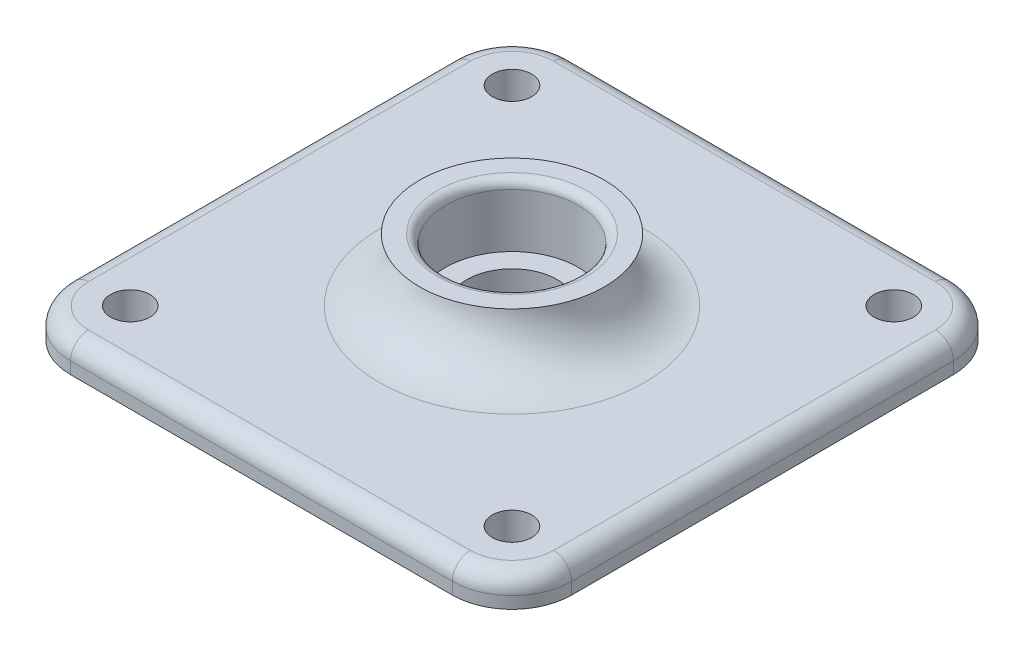
from build123d import *

# Parameters (mm, degrees)
BOSS_EXTRUDE1_DEPTH      = 5
FILLET1_R                = 3
M6_CLEARANCE_HOLE1_D     = 6.6
M6_CLEARANCE_HOLE1_DEPTH = 8
M6_CLEARANCE_HOLE1_TIP   = 1.982840043


with BuildPart() as part:
    # Sketch1 → Boss-Extrude1 (new body)
    with BuildSketch(Plane(origin=(0, 0, 0), x_dir=(1, 0, 0), z_dir=(0, 1, 0))):
        with BuildLine():
            Line((32, 42), (-32, 42))
            ThreePointArc((-32, 42), (-39.071067812, 39.071067812), (-42, 32))
            Line((-42, 32), (-42, -32))
            ThreePointArc((-42, -32), (-39.071067812, -39.071067812), (-32, -42))
            Line((-32, -42), (32, -42))
            ThreePointArc((32, -42), (39.071067812, -39.071067812), (42, -32))
            Line((42, -32), (42, 32))
            ThreePointArc((42, 32), (39.071067812, 39.071067812), (32, 42))
        make_face()
    extrude(amount=BOSS_EXTRUDE1_DEPTH)

    # Sketch3 → Revolve2 (revolve)
    with BuildSketch(Plane.XY):
        with BuildLine():
            Line((-22.25, 5), (-11.15, 5))
            Line((-11.15, 5), (-11.15, 14))
            ThreePointArc((-11.15, 14), (-11.537197996, 15.009021804), (-12.5, 15.5))
            Line((-12.5, 15.5), (-15.5, 15.5))
            ThreePointArc((-15.5, 15.5), (-13.822949017, 15.104101966), (-12.5, 14))
            ThreePointArc((-12.5, 14), (-15.66727432, 7.649963846), (-22.25, 5))
        make_face()
    revolve(axis=Axis((0, 0, 0), (0, -1, 0)))

    # Sketch3<5> → Cut-Revolve2 (revolve, cut)
    with BuildSketch(Plane.XY):
        with BuildLine():
            Line((0, 0), (0, 5))
            Line((0, 5), (-7.6, 5))
            ThreePointArc((-7.6, 5), (-8.694616444, 4.701278719), (-9.6, 4.017392631))
            Line((-9.6, 4.017392631), (-9.6, 0))
            Line((-9.6, 0), (0, 0))
        make_face()
    revolve(axis=Axis((0, 0, 0), (0, -1, 0)), mode=Mode.SUBTRACT)

    # Fillet1
    fillet1_edges = [part.edges().sort_by_distance(p)[0] for p in [
        (42, 5, 0),
        (39.071067812, 5, -39.071067812),
        (0, 5, -42),
        (-39.071067812, 5, -39.071067812),
        (-42, 5, 0),
        (-39.071067812, 5, 39.071067812),
        (0, 5, 42),
        (39.071067812, 5, 39.071067812),
    ]]
    fillet(fillet1_edges, radius=FILLET1_R)

    # M6 Clearance Hole1
    with Locations(Plane(origin=(0, 5, 0), x_dir=(1, 0, 0), z_dir=(0, 1, 0))):
        with Locations((-32, 32), (-32, -32), (32, -32), (32, 32)):
            Hole(M6_CLEARANCE_HOLE1_D / 2, depth=M6_CLEARANCE_HOLE1_DEPTH)
            with Locations((0, 0, -(M6_CLEARANCE_HOLE1_DEPTH + M6_CLEARANCE_HOLE1_TIP / 2))):  # 118° drill point
                Cone(0, M6_CLEARANCE_HOLE1_D / 2, M6_CLEARANCE_HOLE1_TIP, mode=Mode.SUBTRACT)


solid = part.part
